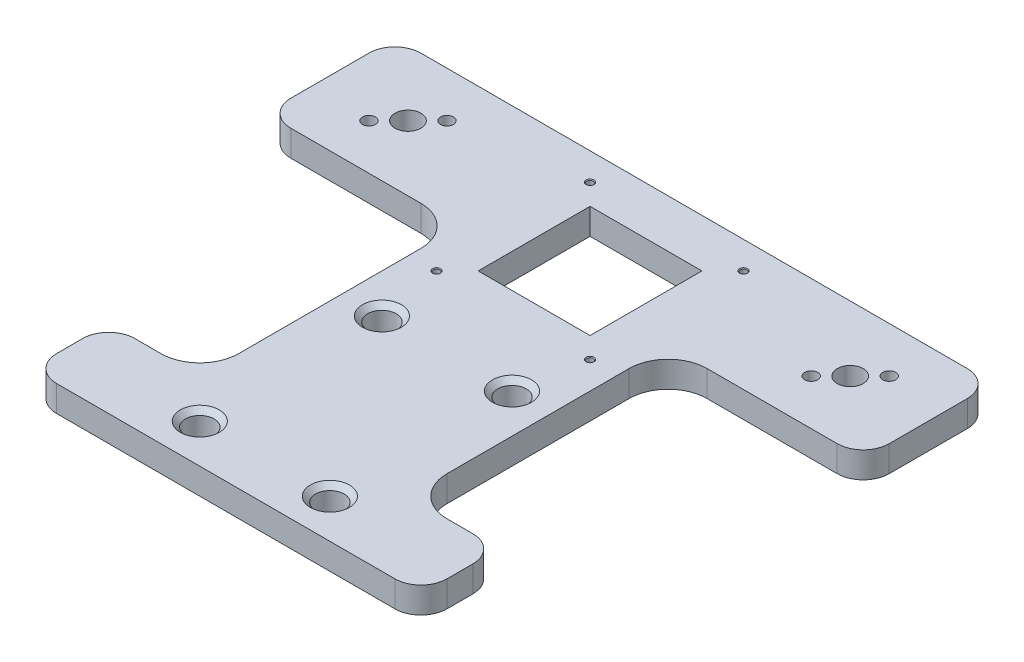
from build123d import *

# Parameters (mm, degrees)
AUFSATZ_LINEAR_AUSTRAGEN1_DEPTH    = 10
F_10_0_10_DURCHMESSER_BOHRUNG1_D   = 10
SKIZZE8_W                          = 43
SKIZZE8_H                          = 43
SCHNITT_LINEAR_AUSTRAGEN2_DEPTH    = 10
M3_GEWINDEBOHRUNG1_D               = 2.5
M3_GEWINDEBOHRUNG1_DEPTH           = 8
M3_GEWINDEBOHRUNG1_CSINK_D         = 3.05
M3_GEWINDEBOHRUNG1_CSINK_ANGLE     = 90
M3_GEWINDEBOHRUNG1_TIP             = 0.751075774
F_5_0_5_DURCHMESSER_BOHRUNG1_D     = 5
DURCHGANGSLOCH_F_R_M101_AT_2_COUNT = 2
DURCHGANGSLOCH_F_R_M101_AT_2_PITCH = 70
DURCHGANGSLOCH_F_R_M101_AT_3_COUNT = 2
DURCHGANGSLOCH_F_R_M101_AT_3_PITCH = 50
DURCHGANGSLOCH_F_R_M101_AT_4_COUNT = 2
DURCHGANGSLOCH_F_R_M101_AT_4_PITCH = 86.02325267


with BuildPart() as part:
    # Skizze1 → Aufsatz-Linear austragen1 (new body)
    with BuildSketch(Plane(origin=(0, 0, 0), x_dir=(1, 0, 0), z_dir=(0, 1, 0))):
        with BuildLine():
            Line((-105, 90), (105, 90))
            ThreePointArc((105, 90), (112.071067812, 87.071067812), (115, 80))
            Line((115, 80), (115, 50))
            ThreePointArc((115, 50), (112.071067812, 42.928932188), (105, 40))
            Line((105, 40), (55, 40))
            ThreePointArc((55, 40), (44.393398282, 35.606601718), (40, 25))
            Line((40, 25), (40, -45))
            ThreePointArc((40, -45), (44.393398282, -55.606601718), (55, -60))
            Line((55, -60), (65, -60))
            ThreePointArc((65, -60), (72.071067812, -62.928932188), (75, -70))
            Line((75, -70), (75, -80))
            ThreePointArc((75, -80), (72.071067812, -87.071067812), (65, -90))
            Line((65, -90), (-65, -90))
            ThreePointArc((-65, -90), (-72.071067812, -87.071067812), (-75, -80))
            Line((-75, -80), (-75, -70))
            ThreePointArc((-75, -70), (-72.071067812, -62.928932188), (-65, -60))
            Line((-65, -60), (-55, -60))
            ThreePointArc((-55, -60), (-44.393398282, -55.606601718), (-40, -45))
            Line((-40, -45), (-40, 25))
            ThreePointArc((-40, 25), (-44.393398282, 35.606601718), (-55, 40))
            Line((-55, 40), (-105, 40))
            ThreePointArc((-105, 40), (-112.071067812, 42.928932188), (-115, 50))
            Line((-115, 50), (-115, 80))
            ThreePointArc((-115, 80), (-112.071067812, 87.071067812), (-105, 90))
        make_face()
    extrude(amount=AUFSATZ_LINEAR_AUSTRAGEN1_DEPTH)

    # Ø10.0 (10) Durchmesser Bohrung1 (through all)
    with Locations(Plane(origin=(0, 10, 0), x_dir=(1, 0, 0), z_dir=(0, 1, 0))):
        with Locations((-85, 65), (85, 65)):
            Hole(F_10_0_10_DURCHMESSER_BOHRUNG1_D / 2)

    # Skizze8 → Schnitt-Linear austragen2 (cut)
    with BuildSketch(Plane(origin=(0, 10, 0), x_dir=(1, 0, 0), z_dir=(0, 1, 0))):
        with Locations((0, 50)):
            Rectangle(SKIZZE8_W, SKIZZE8_H)
    extrude(amount=-SCHNITT_LINEAR_AUSTRAGEN2_DEPTH, mode=Mode.SUBTRACT)

    # M3 Gewindebohrung1
    with Locations(Plane(origin=(0, 10, 0), x_dir=(1, 0, 0), z_dir=(0, 1, 0))):
        with Locations((-29.5, 79.5), (-29.5, 20.5), (29.5, 20.5), (29.5, 79.5)):
            CounterSinkHole(M3_GEWINDEBOHRUNG1_D / 2, M3_GEWINDEBOHRUNG1_CSINK_D / 2, depth=M3_GEWINDEBOHRUNG1_DEPTH, counter_sink_angle=M3_GEWINDEBOHRUNG1_CSINK_ANGLE)
            with Locations((0, 0, -(M3_GEWINDEBOHRUNG1_DEPTH + M3_GEWINDEBOHRUNG1_TIP / 2))):  # 118° drill point
                Cone(0, M3_GEWINDEBOHRUNG1_D / 2, M3_GEWINDEBOHRUNG1_TIP, mode=Mode.SUBTRACT)

    # Ø5.0 (5) Durchmesser Bohrung1 (through all)
    with Locations(Plane(origin=(0, 0, 0), x_dir=(-1, 0, 0), z_dir=(0, -1, 0))):
        with Locations((77.5, 72.5), (92.5, 57.5), (-92.5, 72.5), (-77.5, 57.5)):
            Hole(F_5_0_5_DURCHMESSER_BOHRUNG1_D / 2)

    # Skizze14 → Durchgangsloch für M101 (revolve, cut)
    with BuildSketch(Plane(origin=(25, 0, 5), x_dir=(0, 0, -1), z_dir=(1, 0, 0))):
        Polygon((0, 0), (0, 10), (7.5, 10), (5.5, 8), (5.5, 0), align=None)
    durchgangsloch_f_r_m101 = revolve(axis=Axis((25, -6.35, 5), (0, 1, 0)), mode=Mode.SUBTRACT)

    # Durchgangsloch für M101 at 2: Durchgangsloch für M101 ×2
    with Locations(*[(0, 0, i * DURCHGANGSLOCH_F_R_M101_AT_2_PITCH) for i in range(1, DURCHGANGSLOCH_F_R_M101_AT_2_COUNT)]):
        add(durchgangsloch_f_r_m101, mode=Mode.SUBTRACT)

    # Durchgangsloch für M101 at 3: Durchgangsloch für M101 ×2
    with Locations(*[(-i * DURCHGANGSLOCH_F_R_M101_AT_3_PITCH, 0, 0) for i in range(1, DURCHGANGSLOCH_F_R_M101_AT_3_COUNT)]):
        add(durchgangsloch_f_r_m101, mode=Mode.SUBTRACT)

    # Durchgangsloch für M101 at 4: Durchgangsloch für M101 ×2
    with Locations(*[Vector(-0.5812381937190965, 0, 0.813733471206735) * (i * DURCHGANGSLOCH_F_R_M101_AT_4_PITCH) for i in range(1, DURCHGANGSLOCH_F_R_M101_AT_4_COUNT)]):
        add(durchgangsloch_f_r_m101, mode=Mode.SUBTRACT)


solid = part.part
